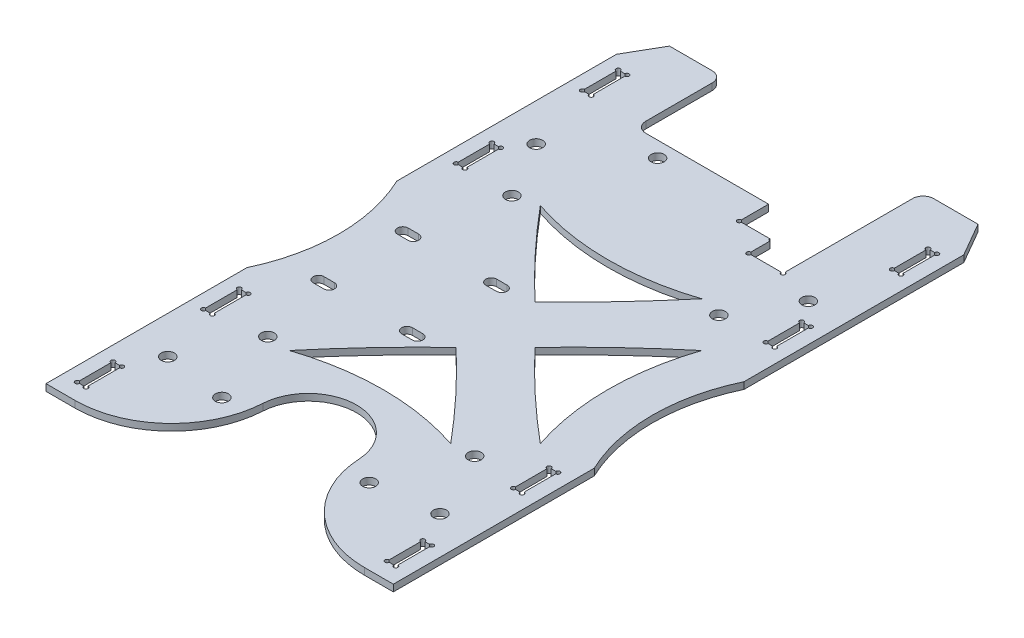
from build123d import *

# Parameters (mm, degrees)
SKETCH1_W               = 2.1
SKETCH1_H               = 8.5
SKETCH1_R               = 1.55
EXTRUDE_8657_DEPTH      = 1.6
CUT_EXTRUDE_9042_DEPTH  = 98.639296877
CUT_EXTRUDE_9381_DEPTH  = 98.639296877
CUT_EXTRUDE_9654_DEPTH  = 10
FILLET_1_R              = 2.5
SKETCH_9947_R           = 0.5
CUT_EXTRUDE_10465_DEPTH = 98.639296877


with BuildPart() as part:
    # Sketch1 → Extrude 8657 (new body)
    with BuildSketch(Plane(origin=(0, 0, 0), x_dir=(1, 0, 0), z_dir=(0, 1, 0))):
        with BuildLine():
            Line((-41.25, 0), (-41.25, -55))
            Line((-41.25, -55), (-34.369560329, -55))
            ThreePointArc((-34.369560329, -55), (-18.59120626, -48.721265785), (-11.440696816, -33.31837076))
            ThreePointArc((-11.440696816, -33.31837076), (-7.872843983, -25.632867641), (0, -22.5))
            ThreePointArc((0, -22.5), (7.872843983, -25.632867641), (11.440696816, -33.31837076))
            ThreePointArc((11.440696816, -33.31837076), (18.59120626, -48.721265785), (34.369560329, -55))
            Line((34.369560329, -55), (41.25, -55))
            Line((41.25, -55), (41.25, 0))
            Line((41.25, 0), (41.25, 80.5))
            Line((41.25, 80.5), (36.640789302, 88.483387111))
            Line((36.640789302, 88.483387111), (-36.640789302, 88.483387111))
            Line((-36.640789302, 88.483387111), (-41.25, 80.5))
            Line((-41.25, 80.5), (-41.25, 0))
        make_face()
        with Locations((-36.8, -46.75)):
            Rectangle(SKETCH1_W, SKETCH1_H, mode=Mode.SUBTRACT)
        with Locations(Location((-32.325, -35, 0), (0, 0, 270))):
            Circle(SKETCH1_R, mode=Mode.SUBTRACT)
        with Locations(Location((-17.5, -36.97765453, 0), (0, 0, 270))):
            Circle(SKETCH1_R, mode=Mode.SUBTRACT)
        with Locations((-36.8, -16.75)):
            Rectangle(SKETCH1_W, SKETCH1_H, mode=Mode.SUBTRACT)
        with Locations(Location((-24.575, -19, 0), (0, 0, 270))):
            Circle(SKETCH1_R, mode=Mode.SUBTRACT)
        with Locations(Location((17.5, -36.97765453, 0), (0, 0, 270))):
            Circle(SKETCH1_R, mode=Mode.SUBTRACT)
        with Locations((36.8, -46.75)):
            Rectangle(SKETCH1_W, SKETCH1_H, mode=Mode.SUBTRACT)
        with Locations(Location((32.325, -35, 0), (0, 0, 270))):
            Circle(SKETCH1_R, mode=Mode.SUBTRACT)
        with Locations(Location((24.575, -19, 0), (0, 0, 270))):
            Circle(SKETCH1_R, mode=Mode.SUBTRACT)
        with Locations((36.8, -16.75)):
            Rectangle(SKETCH1_W, SKETCH1_H, mode=Mode.SUBTRACT)
        with Locations((-36.8, 43.25)):
            Rectangle(SKETCH1_W, SKETCH1_H, mode=Mode.SUBTRACT)
        with Locations(Location((-32.325, 52.5, 0), (0, 0, 270))):
            Circle(SKETCH1_R, mode=Mode.SUBTRACT)
        with Locations(Location((-24.575, 39, 0), (0, 0, 270))):
            Circle(SKETCH1_R, mode=Mode.SUBTRACT)
        with Locations((-36.8, 73.25)):
            Rectangle(SKETCH1_W, SKETCH1_H, mode=Mode.SUBTRACT)
        with Locations(Location((-15.000000144, 64.02234547, 0), (0, 0, 270))):
            Circle(SKETCH1_R, mode=Mode.SUBTRACT)
        with Locations(Location((24.575, 39, 0), (0, 0, 270))):
            Circle(SKETCH1_R, mode=Mode.SUBTRACT)
        with Locations((36.8, 43.25)):
            Rectangle(SKETCH1_W, SKETCH1_H, mode=Mode.SUBTRACT)
        with Locations(Location((32.325, 52.5, 0), (0, 0, 270))):
            Circle(SKETCH1_R, mode=Mode.SUBTRACT)
        Polygon((7.65, 60.772345), (7.65, 82.35), (23.6, 82.35), (23.6, 55.25), (15.4, 55.25), (15.4, 60.772345), align=None, mode=Mode.SUBTRACT)
        with Locations((36.8, 73.25)):
            Rectangle(SKETCH1_W, SKETCH1_H, mode=Mode.SUBTRACT)
    extrude(amount=EXTRUDE_8657_DEPTH)

    # 外部切除点示意-1 → Cut-Extrude 9042 (cut, through all)
    with BuildSketch(Plane(origin=(0, 0, 0), x_dir=(1, 0, 0), z_dir=(0, 1, 0))):
        with BuildLine():
            Line((-41.25, 28.319513771), (-41.285942601, -7.350545872))
            ThreePointArc((-41.285942601, -7.350545872), (-37.250021115, 10.480435299), (-41.25, 28.319513771))
        make_face()
        with BuildLine():
            Line((41.25, 28.319513771), (41.285942601, -7.350545872))
            ThreePointArc((41.285942601, -7.350545872), (37.250021115, 10.480435299), (41.25, 28.319513771))
        make_face()
        Polygon((5.1, 67.733387111), (7.65, 67.733387111), (7.65, 82.35), (23.6, 82.35), (23.6, 88.483387111), (5.1, 88.483387111), (-24, 88.483387111), (-24, 67.733387111), align=None)
    extrude(amount=CUT_EXTRUDE_9042_DEPTH, mode=Mode.SUBTRACT)

    # Sketch 9088 → Cut-Extrude 9381 (cut, through all)
    with BuildSketch(Plane(origin=(0, 0, 0), x_dir=(1, 0, 0), z_dir=(0, 1, 0))):
        with BuildLine():
            Line((-30.25, 20.025), (-27.75, 20.025))
            ThreePointArc((-27.75, 20.025), (-26.475, 18.75), (-27.75, 17.475))
            Line((-27.75, 17.475), (-30.25, 17.475))
            ThreePointArc((-30.25, 17.475), (-31.525, 18.75), (-30.25, 20.025))
        make_face()
        with BuildLine():
            Line((-6.75, 20.025), (-9.25, 20.025))
            ThreePointArc((-9.25, 20.025), (-10.525, 18.75), (-9.25, 17.475))
            Line((-9.25, 17.475), (-6.75, 17.475))
            ThreePointArc((-6.75, 17.475), (-5.475, 18.75), (-6.75, 20.025))
        make_face()
        with BuildLine():
            Line((-30.25, -2.525), (-27.75, -2.525))
            ThreePointArc((-27.75, -2.525), (-26.475, -1.25), (-27.75, 0.025))
            Line((-27.75, 0.025), (-30.25, 0.025))
            ThreePointArc((-30.25, 0.025), (-31.525, -1.25), (-30.25, -2.525))
        make_face()
        with BuildLine():
            Line((-6.75, -2.525), (-9.25, -2.525))
            ThreePointArc((-9.25, -2.525), (-10.525, -1.25), (-9.25, 0.025))
            Line((-9.25, 0.025), (-6.75, 0.025))
            ThreePointArc((-6.75, 0.025), (-5.475, -1.25), (-6.75, -2.525))
        make_face()
    extrude(amount=CUT_EXTRUDE_9381_DEPTH, mode=Mode.SUBTRACT)

    # 草图2 → Cut-Extrude 9654 (cut)
    with BuildSketch(Plane(origin=(0, 1.6, 0), x_dir=(1, 0, 0), z_dir=(0, 1, 0))):
        with BuildLine():
            ThreePointArc((9.371867176, 10.52234547), (19.323145451, 20.402758988), (29.820182402, 29.701292521))
            ThreePointArc((29.820182402, 29.701292521), (26.696086154, 10.52234547), (29.820182402, -8.65660158))
            ThreePointArc((29.820182402, -8.65660158), (19.323145451, 0.641931952), (9.371867176, 10.52234547))
        make_face()
        with BuildLine():
            ThreePointArc((0, 1.150478295), (9.880413518, -8.800799981), (19.178947051, -19.297836932))
            ThreePointArc((19.178947051, -19.297836932), (0, -16.173740684), (-19.178947051, -19.297836932))
            ThreePointArc((-19.178947051, -19.297836932), (-9.880413518, -8.800799981), (0, 1.150478295))
        make_face()
        with BuildLine():
            ThreePointArc((0, 19.894212646), (-9.880413518, 29.845490922), (-19.178947051, 40.342527872))
            ThreePointArc((-19.178947051, 40.342527872), (0, 37.218431624), (19.178947051, 40.342527872))
            ThreePointArc((19.178947051, 40.342527872), (9.880413518, 29.845490922), (0, 19.894212646))
        make_face()
    extrude(amount=-CUT_EXTRUDE_9654_DEPTH, mode=Mode.SUBTRACT)

    # 圆角1
    fillet_1_edges = [part.edges().sort_by_distance(p)[0] for p in [
        (23.6, 0.8, -88.483387111),
        (-24, 0.8, -88.483387111),
        (-24, 0.8, -67.733387111),
    ]]
    fillet(fillet_1_edges, radius=FILLET_1_R)

    # Sketch 9947 → Cut-Extrude 10465 (cut, through all)
    with BuildSketch(Plane(origin=(0, 0, 0), x_dir=(1, 0, 0), z_dir=(0, 1, 0))):
        with Locations((7.65, 60.772345)):
            Circle(SKETCH_9947_R)
        with Locations((15.4, 60.772345)):
            Circle(SKETCH_9947_R)
        with Locations((15.4, 55.25)):
            Circle(SKETCH_9947_R)
        with Locations((23.6, 55.25)):
            Circle(SKETCH_9947_R)
        with Locations((35.75, 69)):
            Circle(SKETCH_9947_R)
        with Locations((37.85, 69)):
            Circle(SKETCH_9947_R)
        with Locations((35.75, 77.5)):
            Circle(SKETCH_9947_R)
        with Locations((37.85, 77.5)):
            Circle(SKETCH_9947_R)
        with Locations((35.75, 47.5)):
            Circle(SKETCH_9947_R)
        with Locations((37.85, 47.5)):
            Circle(SKETCH_9947_R)
        with Locations((35.75, 39)):
            Circle(SKETCH_9947_R)
        with Locations((37.85, 39)):
            Circle(SKETCH_9947_R)
        with Locations((35.75, -12.5)):
            Circle(SKETCH_9947_R)
        with Locations((37.85, -12.5)):
            Circle(SKETCH_9947_R)
        with Locations((35.75, -21)):
            Circle(SKETCH_9947_R)
        with Locations((37.85, -21)):
            Circle(SKETCH_9947_R)
        with Locations((35.75, -42.5)):
            Circle(SKETCH_9947_R)
        with Locations((37.85, -42.5)):
            Circle(SKETCH_9947_R)
        with Locations((35.75, -51)):
            Circle(SKETCH_9947_R)
        with Locations((37.85, -51)):
            Circle(SKETCH_9947_R)
        with Locations((-37.85, -51)):
            Circle(SKETCH_9947_R)
        with Locations((-35.75, -51)):
            Circle(SKETCH_9947_R)
        with Locations((-37.85, -42.5)):
            Circle(SKETCH_9947_R)
        with Locations((-35.75, -42.5)):
            Circle(SKETCH_9947_R)
        with Locations((-37.85, -21)):
            Circle(SKETCH_9947_R)
        with Locations((-35.75, -21)):
            Circle(SKETCH_9947_R)
        with Locations((-37.85, -12.5)):
            Circle(SKETCH_9947_R)
        with Locations((-35.75, -12.5)):
            Circle(SKETCH_9947_R)
        with Locations((-37.85, 39)):
            Circle(SKETCH_9947_R)
        with Locations((-35.75, 39)):
            Circle(SKETCH_9947_R)
        with Locations((-37.85, 47.5)):
            Circle(SKETCH_9947_R)
        with Locations((-35.75, 47.5)):
            Circle(SKETCH_9947_R)
        with Locations((-37.85, 77.5)):
            Circle(SKETCH_9947_R)
        with Locations((-35.75, 77.5)):
            Circle(SKETCH_9947_R)
        with Locations((-37.85, 69)):
            Circle(SKETCH_9947_R)
        with Locations((-35.75, 69)):
            Circle(SKETCH_9947_R)
    extrude(amount=CUT_EXTRUDE_10465_DEPTH, mode=Mode.SUBTRACT)


solid = part.part
